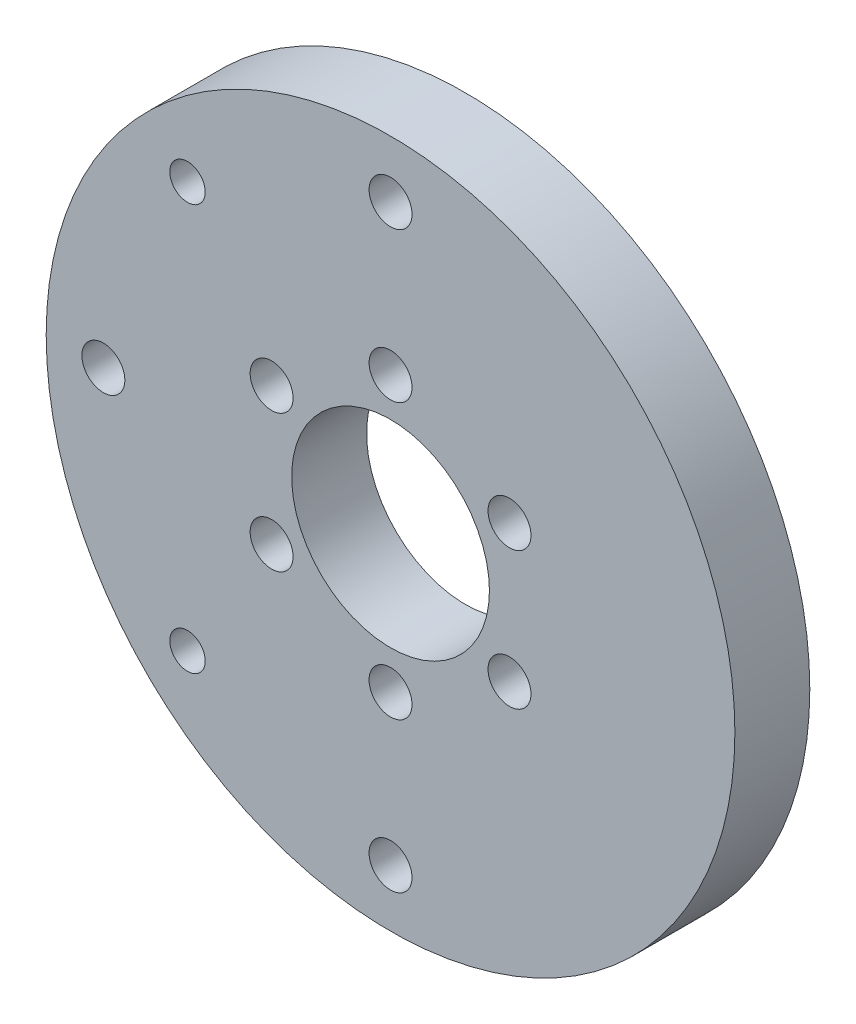
from build123d import *

# Parameters (mm, degrees)
SKETCH1_R           = 27.5
SKETCH1_R_2         = 8
SKETCH1_R_3         = 1.8
SKETCH1_R_4         = 1.5
BOSS_EXTRUDE1_DEPTH = 6
MOVE_FACE1_BY       = 0.08
MOVE_FACE1_2_BY     = 0.08
MOVE_FACE1_3_BY     = 0.08
MOVE_FACE1_4_BY     = 0.08
MOVE_FACE1_5_BY     = 0.08
MOVE_FACE1_6_BY     = 0.08
MOVE_FACE1_7_BY     = 0.08
MOVE_FACE1_8_BY     = 0.08
MOVE_FACE1_9_BY     = 0.08
MOVE_FACE1_10_BY    = 0.08
MOVE_FACE1_11_BY    = 0.08
MOVE_FACE1_12_BY    = 0.08
MOVE_FACE1_13_BY    = 0.08


with BuildPart() as part:
    # Sketch1 → Boss-Extrude1 (new body)
    with BuildSketch(Plane.XY):
        Circle(SKETCH1_R)
        Circle(SKETCH1_R_2, mode=Mode.SUBTRACT)
        with Locations((0, 23)):
            Circle(SKETCH1_R_3, mode=Mode.SUBTRACT)
        with Locations((0, -23)):
            Circle(SKETCH1_R_3, mode=Mode.SUBTRACT)
        with Locations((-16.263455967, -16.263455967)):
            Circle(SKETCH1_R_4, mode=Mode.SUBTRACT)
        with Locations((-23, 0)):
            Circle(SKETCH1_R_3, mode=Mode.SUBTRACT)
        with Locations((-16.263455967, 16.263455967)):
            Circle(SKETCH1_R_4, mode=Mode.SUBTRACT)
        with Locations((0, 11)):
            Circle(SKETCH1_R_3, mode=Mode.SUBTRACT)
        with Locations((9.526279442, 5.5)):
            Circle(SKETCH1_R_3, mode=Mode.SUBTRACT)
        with Locations((9.526279442, -5.5)):
            Circle(SKETCH1_R_3, mode=Mode.SUBTRACT)
        with Locations((0, -11)):
            Circle(SKETCH1_R_3, mode=Mode.SUBTRACT)
        with Locations((-9.526279442, -5.5)):
            Circle(SKETCH1_R_3, mode=Mode.SUBTRACT)
        with Locations((-9.526279442, 5.5)):
            Circle(SKETCH1_R_3, mode=Mode.SUBTRACT)
    extrude(amount=BOSS_EXTRUDE1_DEPTH)

    # Move Face1: a curved face moved outward by 0.08
    add(Solid.thicken(part.faces().sort_by_distance((-17.763455967, -16.263455967, 3))[0], MOVE_FACE1_BY))

    # Move Face1 2: a curved face moved outward by 0.08
    add(Solid.thicken(part.faces().sort_by_distance((-24.8, 0, 3))[0], MOVE_FACE1_2_BY))

    # Move Face1 3: a curved face moved outward by 0.08
    add(Solid.thicken(part.faces().sort_by_distance((-17.763455967, 16.263455967, 3))[0], MOVE_FACE1_3_BY))

    # Move Face1 4: a curved face moved outward by 0.08
    add(Solid.thicken(part.faces().sort_by_distance((-1.8, 23, 3))[0], MOVE_FACE1_4_BY))

    # Move Face1 5: a curved face moved outward by 0.08
    add(Solid.thicken(part.faces().sort_by_distance((-27.5, 0, 3))[0], MOVE_FACE1_5_BY))

    # Move Face1 6: a curved face moved outward by 0.08
    add(Solid.thicken(part.faces().sort_by_distance((-8, 0, 3))[0], MOVE_FACE1_6_BY))

    # Move Face1 7: a curved face moved outward by 0.08
    add(Solid.thicken(part.faces().sort_by_distance((-1.8, 11, 3))[0], MOVE_FACE1_7_BY))

    # Move Face1 8: a curved face moved outward by 0.08
    add(Solid.thicken(part.faces().sort_by_distance((-1.8, -23, 3))[0], MOVE_FACE1_8_BY))

    # Move Face1 9: a curved face moved outward by 0.08
    add(Solid.thicken(part.faces().sort_by_distance((7.726279442, 5.5, 3))[0], MOVE_FACE1_9_BY))

    # Move Face1 10: a curved face moved outward by 0.08
    add(Solid.thicken(part.faces().sort_by_distance((7.726279442, -5.5, 3))[0], MOVE_FACE1_10_BY))

    # Move Face1 11: a curved face moved outward by 0.08
    add(Solid.thicken(part.faces().sort_by_distance((-1.8, -11, 3))[0], MOVE_FACE1_11_BY))

    # Move Face1 12: a curved face moved outward by 0.08
    add(Solid.thicken(part.faces().sort_by_distance((-11.326279442, -5.5, 3))[0], MOVE_FACE1_12_BY))

    # Move Face1 13: a curved face moved outward by 0.08
    add(Solid.thicken(part.faces().sort_by_distance((-11.326279442, 5.5, 3))[0], MOVE_FACE1_13_BY))


solid = part.part
